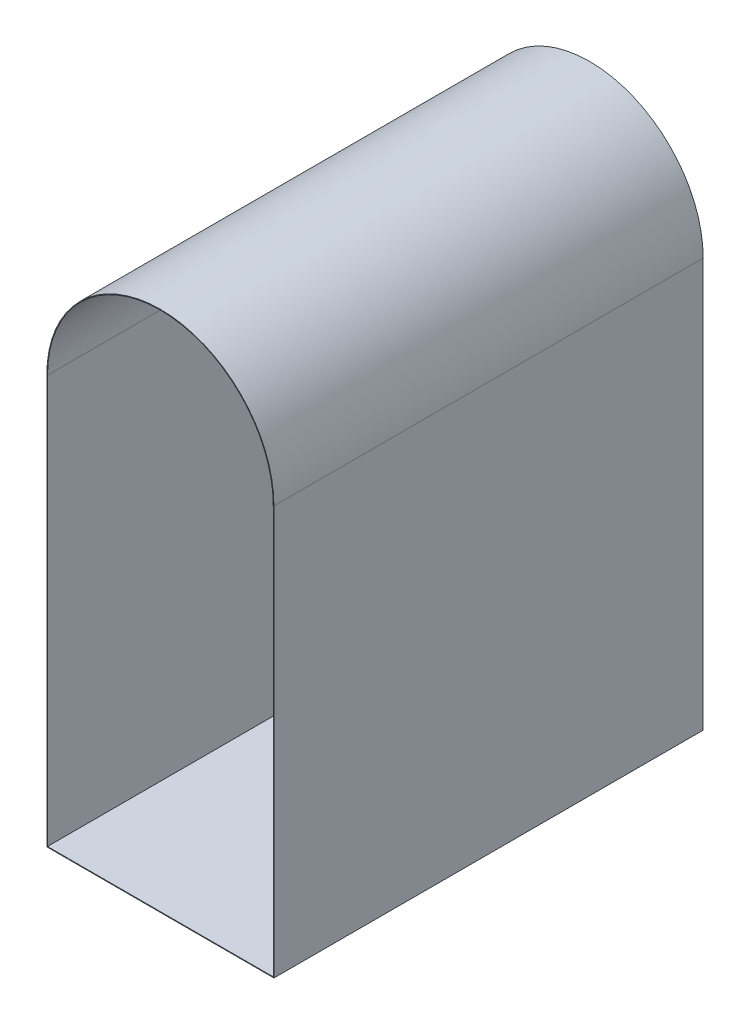
from build123d import *

# Parameters (mm, degrees)
BOSS_EXTRUDE1_DEPTH = 189
SHELL2_T            = -0.3


with BuildPart() as part:
    # Sketch1 → Boss-Extrude1 (new body)
    with BuildSketch(Plane.XY):
        with BuildLine():
            Line((-50, -31.525272579), (50, -31.525272579))
            Line((50, -31.525272579), (50, 148.474727421))
            ThreePointArc((50, 148.474727421), (0, 198.474727421), (-50, 148.474727421))
            Line((-50, 148.474727421), (-50, -31.525272579))
        make_face()
    extrude(amount=BOSS_EXTRUDE1_DEPTH)

    # Shell2
    shell2_openings = [part.faces().sort_by_distance(p)[0] for p in [
        (0, 78.393671634, 189),
    ]]
    offset(amount=SHELL2_T, openings=shell2_openings, kind=Kind.INTERSECTION)


solid = part.part
